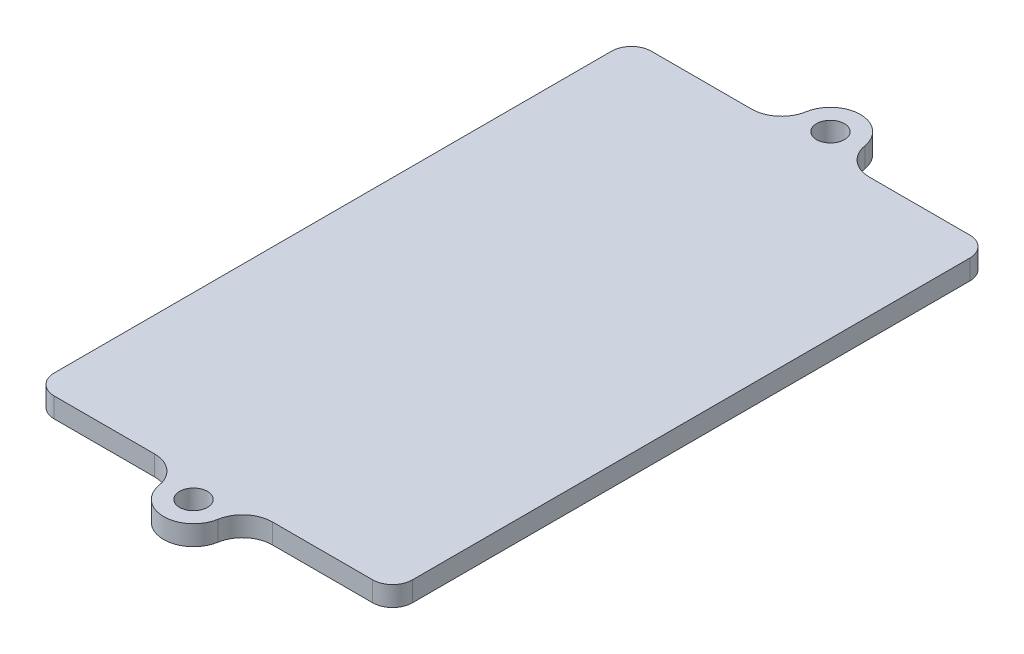
from build123d import *

# Parameters (mm, degrees)
SKETCH_1_W      = 36
SKETCH_1_H      = 60
EXTRUDE_1_DEPTH = 2
FILLET_1_R      = 2
SKETCH_2_R      = 1.4
EXTRUDE_2_DEPTH = 2
FILLET_2_R      = 3


with BuildPart() as part:
    # 草图1 → 凸台-拉伸1 (new body)
    with BuildSketch(Plane(origin=(0, 0, 0), x_dir=(1, 0, 0), z_dir=(0, 1, 0))):
        Rectangle(SKETCH_1_W, SKETCH_1_H)
    extrude(amount=EXTRUDE_1_DEPTH)

    # 圆角1
    fillet_1_edges = [part.edges().sort_by_distance(p)[0] for p in [
        (-18, 1, -30),
        (18, 1, -30),
        (18, 1, 30),
        (-18, 1, 30),
    ]]
    fillet(fillet_1_edges, radius=FILLET_1_R)

    # 草图2 → 凸台-拉伸2 (add)
    # profile 1 of 2: a face of its own
    with BuildSketch(Plane(origin=(0, 2, 0), x_dir=(1, 0, 0), z_dir=(0, 1, 0))):
        with BuildLine():
            ThreePointArc((2.236067977, 30), (2.802517077, 30.929533731), (3, 32))
            ThreePointArc((3, 32), (-1.070466269, 34.802517077), (-2.236067977, 30))
            Line((-2.236067977, 30), (2.236067977, 30))
        make_face()
        with Locations(Location((0, 32, 0), (0, 0, 270))):
            Circle(SKETCH_2_R, mode=Mode.SUBTRACT)
    # profile 2 of 2: a face of its own
    with BuildSketch(Plane(origin=(0, 2, 0), x_dir=(1, 0, 0), z_dir=(0, 1, 0))):
        with BuildLine():
            ThreePointArc((-2.236067977, -30), (-1.070466269, -34.802517077), (3, -32))
            ThreePointArc((3, -32), (2.802517077, -30.929533731), (2.236067977, -30))
            Line((2.236067977, -30), (-2.236067977, -30))
        make_face()
        with Locations(Location((0, -32, 0), (0, 0, 270))):
            Circle(SKETCH_2_R, mode=Mode.SUBTRACT)
    extrude(amount=-EXTRUDE_2_DEPTH)

    # 圆角2
    fillet_2_edges = [part.edges().sort_by_distance(p)[0] for p in [
        (2.236067977, 1, -30),
        (-2.236067977, 1, -30),
        (2.236067977, 1, 30),
        (-2.236067977, 1, 30),
    ]]
    fillet(fillet_2_edges, radius=FILLET_2_R)


solid = part.part
